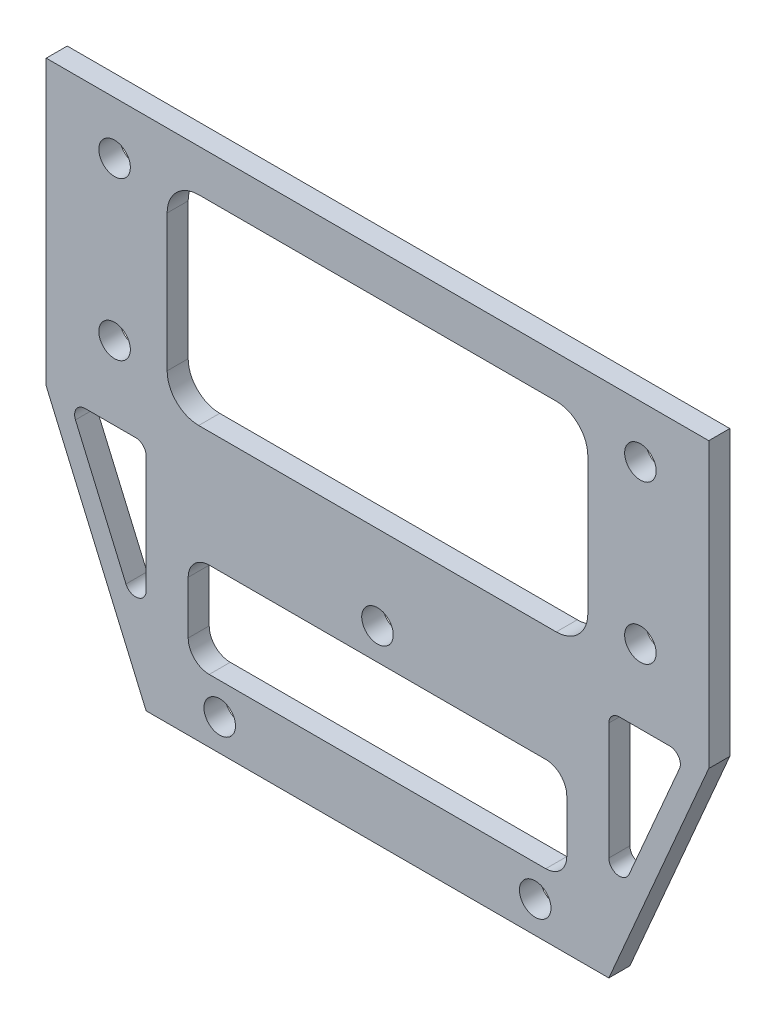
from build123d import *

# Parameters (mm, degrees)
SKETCH_1_R      = 1.5
SKETCH_1_W      = 40
SKETCH_1_H      = 19
SKETCH_1_W_2    = 36
SKETCH_1_H_2    = 9
EXTRUDE_1_DEPTH = 2
EXTRUDE_2_DEPTH = 2
FILLET_1_R      = 3
FILLET_2_R      = 2
FILLET_3_R      = 1


with BuildPart() as part:
    # 草图1 → 凸台-拉伸1 (new body)
    with BuildSketch(Plane.XY):
        Polygon((-31.5, -2), (-22, -2), (-22, -24), (22, -24), (22, -2), (31.5, -2), (31.5, 25), (-31.5, 25), align=None)
        with Locations((-25, 20)):
            Circle(SKETCH_1_R, mode=Mode.SUBTRACT)
        with Locations((25, 20)):
            Circle(SKETCH_1_R, mode=Mode.SUBTRACT)
        with Locations((-25, 5)):
            Circle(SKETCH_1_R, mode=Mode.SUBTRACT)
        with Locations((25, 5)):
            Circle(SKETCH_1_R, mode=Mode.SUBTRACT)
        with Locations((0, -6)):
            Circle(SKETCH_1_R, mode=Mode.SUBTRACT)
        with Locations((-15, -21)):
            Circle(SKETCH_1_R, mode=Mode.SUBTRACT)
        with Locations((15, -21)):
            Circle(SKETCH_1_R, mode=Mode.SUBTRACT)
        with Locations((0, 11.5)):
            Rectangle(SKETCH_1_W, SKETCH_1_H, mode=Mode.SUBTRACT)
        with Locations((0, -13.5)):
            Rectangle(SKETCH_1_W_2, SKETCH_1_H_2, mode=Mode.SUBTRACT)
    extrude(amount=EXTRUDE_1_DEPTH)

    # 草图2 → 凸台-拉伸2 (add)
    with BuildSketch(Plane.XY.offset(2)):
        Polygon((-31.5, -2), (-22, -24), (-22, -18.955049698), (-29.321498733, -2), align=None)
        Polygon((31.5, -2), (22, -24), (22, -18.955049698), (29.321498733, -2), align=None)
    extrude(amount=-EXTRUDE_2_DEPTH)

    # 圆角1
    fillet_1_edges = [part.edges().sort_by_distance(p)[0] for p in [
        (20, 2, 1),
        (20, 21, 1),
        (-20, 21, 1),
        (-20, 2, 1),
    ]]
    fillet(fillet_1_edges, radius=FILLET_1_R)

    # 圆角2
    fillet_2_edges = [part.edges().sort_by_distance(p)[0] for p in [
        (18, -18, 1),
        (18, -9, 1),
        (-18, -9, 1),
        (-18, -18, 1),
    ]]
    fillet(fillet_2_edges, radius=FILLET_2_R)

    # 圆角3
    fillet_3_edges = [part.edges().sort_by_distance(p)[0] for p in [
        (22, -2, 1),
        (-22, -2, 1),
        (-22, -18.955049698, 1),
        (-29.321498733, -2, 1),
        (22, -18.955049698, 1),
        (29.321498733, -2, 1),
    ]]
    fillet(fillet_3_edges, radius=FILLET_3_R)


solid = part.part
